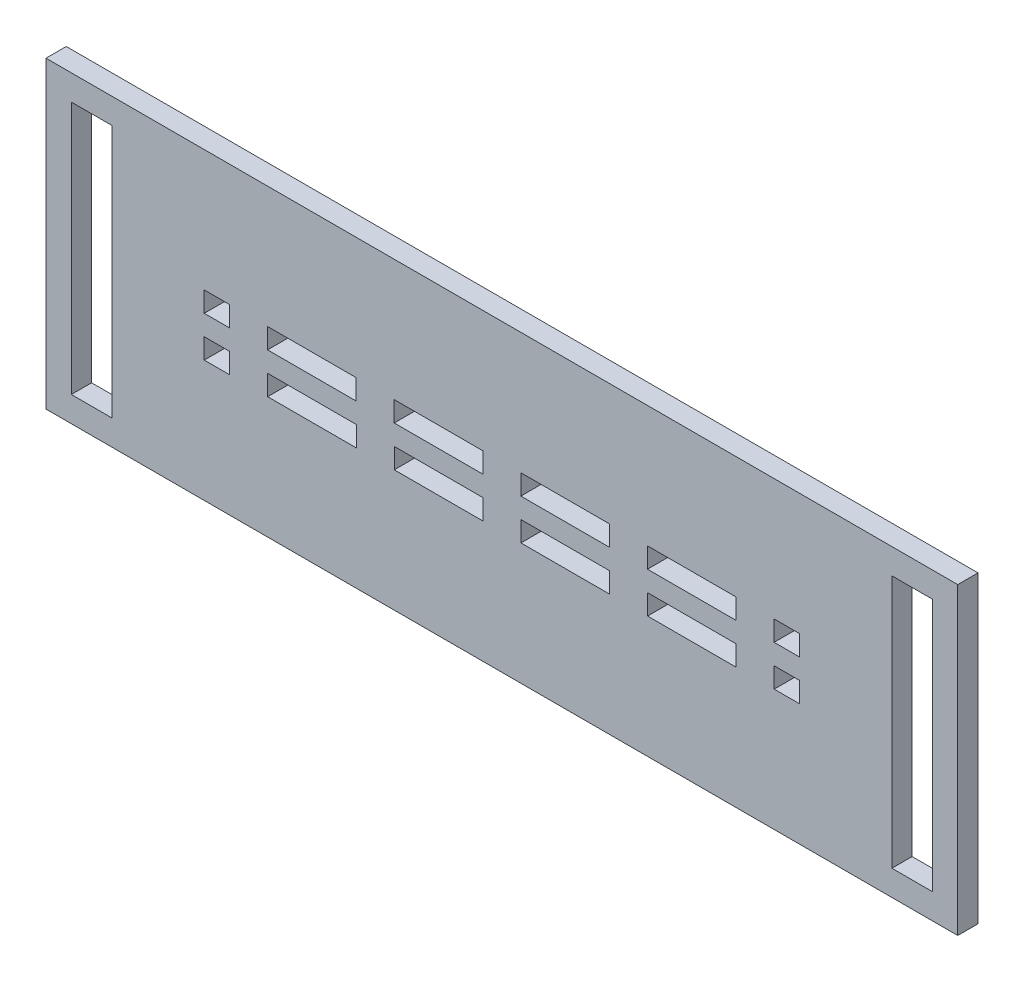
from build123d import *

# Parameters (mm, degrees)
IZIM1_W                     = 360
IZIM1_H                     = 120
IZIM1_W_2                   = 302.16
IZIM1_H_2                   = 8
Y_KSEKLIK_EKSTR_ZYON1_DEPTH = 8
IZIM4_W                     = 16
IZIM4_H                     = 100
KES_EKSTR_ZYON3_DEPTH       = 10
IZIM5_W                     = 35
IZIM5_H                     = 8
IZIM5_W_2                   = 10.030547984
IZIM5_W_3                   = 10
KES_EKSTR_ZYON4_DEPTH       = 8


with BuildPart() as part:
    # Çizim1 → Yükseklik-Ekstrüzyon1 (new body)
    # profile 1 of 3: a face of its own
    with BuildSketch(Plane.XY):
        with Locations((-70.427590571, -6.826190476)):
            Rectangle(IZIM1_W, IZIM1_H)
        with Locations((-70.427590571, 1.173809524)):
            Rectangle(IZIM1_W_2, IZIM1_H_2, mode=Mode.SUBTRACT)
        with Locations((-70.427590571, -14.826190476)):
            Rectangle(IZIM1_W_2, IZIM1_H_2, mode=Mode.SUBTRACT)
    # profile 2 of 3: a face of its own
    with BuildSketch(Plane.XY):
        with Locations((-70.427590571, -14.826190476)):
            Rectangle(IZIM1_W_2, IZIM1_H_2)
    # profile 3 of 3: a face of its own
    with BuildSketch(Plane.XY):
        with Locations((-70.427590571, 1.173809524)):
            Rectangle(IZIM1_W_2, IZIM1_H_2)
    extrude(amount=Y_KSEKLIK_EKSTR_ZYON1_DEPTH)

    # Çizim4 → Kes-Ekstrüzyon3 (cut)
    with BuildSketch(Plane(origin=(0, 0, 0), x_dir=(-1, 0, 0), z_dir=(0, 0, -1))):
        with Locations((232.427590571, -6.826190476)):
            Rectangle(IZIM4_W, IZIM4_H)
        with Locations((-91.572409429, -6.826190476)):
            Rectangle(IZIM4_W, IZIM4_H)
    extrude(amount=-KES_EKSTR_ZYON3_DEPTH, mode=Mode.SUBTRACT)

    # Çizim5 → Kes-Ekstrüzyon4 (cut)
    with BuildSketch(Plane.XY.offset(8)):
        with Locations((-145.442864563, 1.173809524)):
            Rectangle(IZIM5_W, IZIM5_H)
        with Locations((-145.412316579, -14.826190476)):
            Rectangle(IZIM5_W, IZIM5_H)
        with Locations((-182.927590571, -14.826190476)):
            Rectangle(IZIM5_W_2, IZIM5_H)
        with Locations((-182.942864563, 1.173809524)):
            Rectangle(IZIM5_W_3, IZIM5_H)
        with Locations((-95.412316579, -14.826190476)):
            Rectangle(IZIM5_W, IZIM5_H)
        with Locations((-95.442864563, 1.173809524)):
            Rectangle(IZIM5_W, IZIM5_H)
        with Locations((-45.412316579, -14.826190476)):
            Rectangle(IZIM5_W, IZIM5_H)
        with Locations((-45.442864563, 1.173809524)):
            Rectangle(IZIM5_W, IZIM5_H)
        with Locations((4.587683421, -14.826190476)):
            Rectangle(IZIM5_W, IZIM5_H)
        with Locations((4.557135437, 1.173809524)):
            Rectangle(IZIM5_W, IZIM5_H)
        with Locations((42.087683421, -14.826190476)):
            Rectangle(IZIM5_W_3, IZIM5_H)
        with Locations((42.072409429, 1.173809524)):
            Rectangle(IZIM5_W_2, IZIM5_H)
    extrude(amount=-KES_EKSTR_ZYON4_DEPTH, mode=Mode.SUBTRACT)


solid = part.part
